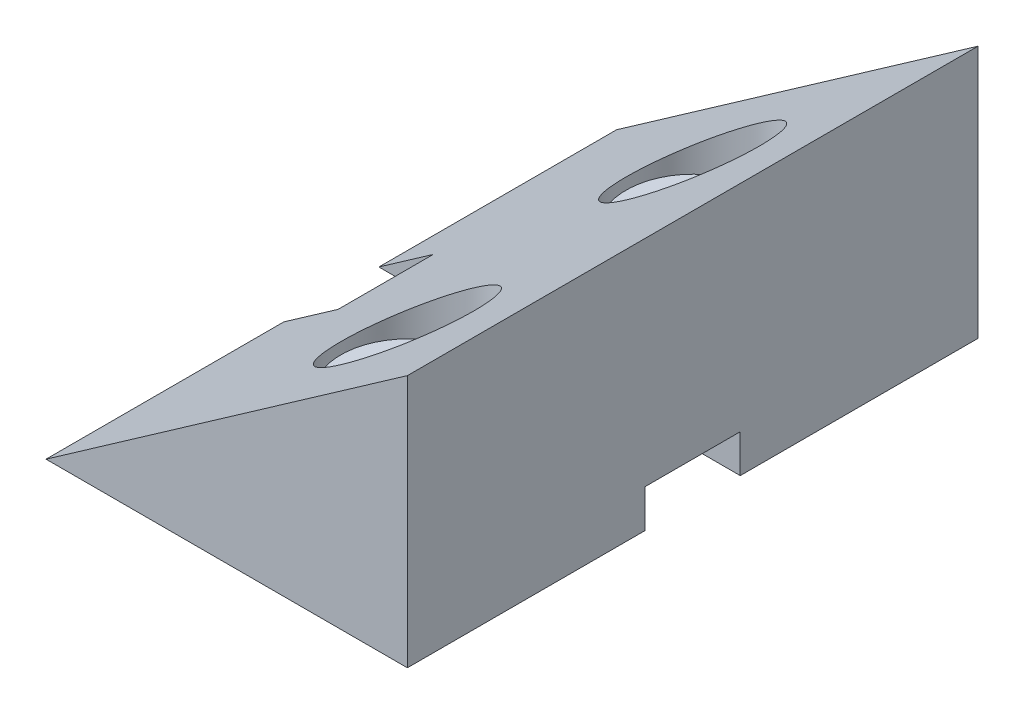
from build123d import *

# Parameters (mm, degrees)
BOSS_EXTRU_1_DEPTH      = 30
ENL_V_MAT_EXTRU_1_REACH = 38.469
ESQUISSE2_R             = 3.5
ENL_V_MAT_EXTRU_2_REACH = 38.469
ESQUISSE3_R             = 1.75
ENL_V_MAT_EXTRU_3_REACH = 39.921
ESQUISSE4_W             = 5
ESQUISSE4_H             = 2


with BuildPart() as part:
    # Esquisse1 → Boss.-Extru.1 (new body)
    with BuildSketch(Plane.XY):
        Polygon((0, 0), (-19, 0), (0, 13.303943226), align=None)
    extrude(amount=BOSS_EXTRU_1_DEPTH)

    # Enlèv. mat.-Extru.1: up to this plane
    enl_v_mat_extru_1_end = Plane(origin=(-19, 0, 30), z_dir=(0.5735764363510416, -0.8191520442889949, 0))
    # Esquisse2 → Enlèv. mat.-Extru.1 (cut, up to the surface)
    with BuildSketch(Plane(origin=(0, 5, 0), x_dir=(-1, 0, 0), z_dir=(0, -1, 0)), mode=Mode.PRIVATE) as enl_v_mat_extru_1_sk1:
        with Locations(Location((7.5, -7.5, 0), (0, 0, 180))):
            Circle(ESQUISSE2_R)
    enl_v_mat_extru_1_tool1 = split(extrude(enl_v_mat_extru_1_sk1.sketch, amount=-ENL_V_MAT_EXTRU_1_REACH, mode=Mode.PRIVATE), bisect_by=enl_v_mat_extru_1_end, keep=Keep.BOTH, mode=Mode.PRIVATE)
    add(enl_v_mat_extru_1_tool1.solids().sort_by_distance((-7.5, 5, 7.5))[0], mode=Mode.SUBTRACT)
    # Esquisse2 → Enlèv. mat.-Extru.1 (cut, up to the surface)
    with BuildSketch(Plane(origin=(0, 5, 0), x_dir=(-1, 0, 0), z_dir=(0, -1, 0)), mode=Mode.PRIVATE) as enl_v_mat_extru_1_sk2:
        with Locations(Location((7.5, -22.5, 0), (0, 0, 180))):
            Circle(ESQUISSE2_R)
    enl_v_mat_extru_1_tool2 = split(extrude(enl_v_mat_extru_1_sk2.sketch, amount=-ENL_V_MAT_EXTRU_1_REACH, mode=Mode.PRIVATE), bisect_by=enl_v_mat_extru_1_end, keep=Keep.BOTH, mode=Mode.PRIVATE)
    add(enl_v_mat_extru_1_tool2.solids().sort_by_distance((-7.5, 5, 22.5))[0], mode=Mode.SUBTRACT)

    # Esquisse3 → Enlèv. mat.-Extru.2 (cut, up to next)
    with BuildSketch(Plane(origin=(0, 5, 0), x_dir=(1, 0, 0), z_dir=(0, 1, 0)), mode=Mode.PRIVATE) as enl_v_mat_extru_2_sk1:
        with Locations(Location((-7.5, -22.5, 0), (0, 0, 180))):
            Circle(ESQUISSE3_R)
    enl_v_mat_extru_2_tool1 = extrude(enl_v_mat_extru_2_sk1.sketch, amount=-ENL_V_MAT_EXTRU_2_REACH, mode=Mode.PRIVATE) & part.part
    # Esquisse3 → Enlèv. mat.-Extru.2 (cut, up to next)
    with BuildSketch(Plane(origin=(0, 5, 0), x_dir=(1, 0, 0), z_dir=(0, 1, 0)), mode=Mode.PRIVATE) as enl_v_mat_extru_2_sk2:
        with Locations(Location((-7.5, -7.5, 0), (0, 0, 180))):
            Circle(ESQUISSE3_R)
    enl_v_mat_extru_2_tool2 = extrude(enl_v_mat_extru_2_sk2.sketch, amount=-ENL_V_MAT_EXTRU_2_REACH, mode=Mode.PRIVATE) & part.part
    add(enl_v_mat_extru_2_tool1.solids().sort_by_distance((-7.5, 5, 22.5))[0], mode=Mode.SUBTRACT)
    add(enl_v_mat_extru_2_tool2.solids().sort_by_distance((-7.5, 5, 7.5))[0], mode=Mode.SUBTRACT)

    # Enlèv. mat.-Extru.3: up to this plane
    enl_v_mat_extru_3_end = Plane(origin=(-19, 0, 30), z_dir=(0.5735764363510416, -0.8191520442889949, 0))
    # Esquisse4 → Enlèv. mat.-Extru.3 (cut, up to the surface)
    with BuildSketch(Plane(origin=(0, 0, 0), x_dir=(0, 0, -1), z_dir=(1, 0, 0)), mode=Mode.PRIVATE) as enl_v_mat_extru_3_sk1:
        with Locations((-15, 1)):
            Rectangle(ESQUISSE4_W, ESQUISSE4_H)
    enl_v_mat_extru_3_tool1 = split(extrude(enl_v_mat_extru_3_sk1.sketch, amount=-ENL_V_MAT_EXTRU_3_REACH, mode=Mode.PRIVATE), bisect_by=enl_v_mat_extru_3_end, keep=Keep.BOTH, mode=Mode.PRIVATE)
    add(enl_v_mat_extru_3_tool1.solids().sort_by_distance((0, 1, 15))[0], mode=Mode.SUBTRACT)


solid = part.part
